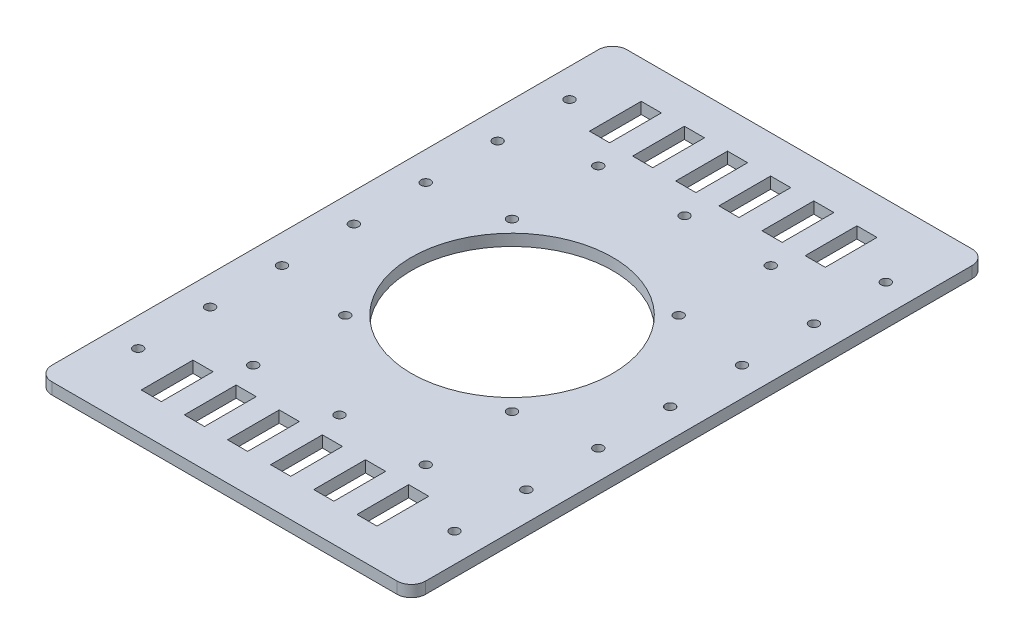
from build123d import *

# Parameters (mm, degrees)
SKETCH_1_W            = 250
SKETCH_1_H            = 100
EXTRUDE_1_DEPTH       = 4
SKETCH_2_R            = 7
SKETCH_2_R_2          = 2
SKETCH_2_R_3          = 12.5
CUT_EXTRUDE_1_DEPTH   = 10
SKETCH_3_W            = 97.153071718
SKETCH_3_H            = 57.170388118
CUT_EXTRUDE_2_DEPTH   = 10
SKETCH_5_R            = 2
CUT_EXTRUDE_3_DEPTH   = 135.688529578
SKETCH_6_W            = 100
SKETCH_6_H            = 4
EXTRUDE_2_DEPTH       = 10
EXTRUDE_3_DEPTH       = 4
SKETCH_9_W            = 57.170388118
SKETCH_9_H            = 4
EXTRUDE_4_DEPTH       = 10
FILLET_1_R            = 10
SKETCH_10_R           = 1.7
CUT_EXTRUDE_5_DEPTH   = 17
SKETCH_11_W           = 87.153071718
SKETCH_11_H           = 57.170388118
EXTRUDE_5_DEPTH       = 4
SKETCH_12_R           = 7
SKETCH_12_R_2         = 2
CUT_EXTRUDE_6_DEPTH   = 10
SKETCH_14_W           = 100
SKETCH_14_H           = 4
CUT_EXTRUDE_7_DEPTH   = 80
SKETCH_15_OUTSIDE_W   = 281.959
SKETCH_15_OUTSIDE_H   = 206.214
SKETCH_15_OUTSIDE_W_2 = 260
SKETCH_15_OUTSIDE_H_2 = 130
CUT_EXTRUDE_8_DEPTH   = 10
EXTRUDE_START         = -4
EXTRUDE_6_DEPTH       = 4
SKETCH_17_W           = 65
SKETCH_17_H           = 130
CUT_EXTRUDE_9_DEPTH   = 10
SKETCH_18_W           = 130
SKETCH_18_H           = 35
EXTRUDE_7_DEPTH       = 4
SKETCH_19_R           = 1.65
CUT_EXTRUDE_10_DEPTH  = 10
SKETCH_20_R           = 12.5
CUT_EXTRUDE_11_DEPTH  = 10
EXTRUDE_8_DEPTH       = 4
SKETCH_22_R           = 1.65
CUT_EXTRUDE_12_DEPTH  = 10
SKETCH_24_W           = 51.023920123
SKETCH_24_H           = 101.084181609
EXTRUDE_10_DEPTH      = 4
SKETCH_26_R           = 11.5
CUT_EXTRUDE_14_DEPTH  = 10
SKETCH_28_R           = 1.65
SKETCH_28_R_2         = 4.15
CUT_EXTRUDE_15_DEPTH  = 10
SKETCH_29_W           = 65
SKETCH_29_H           = 17.5
EXTRUDE_11_DEPTH      = 4
FILLET_4_R            = 5
SKETCH_30_W           = 135.504230547
SKETCH_30_H           = 189.169990082
CUT_EXTRUDE_16_DEPTH  = 10
SKETCH_31_R           = 35
CUT_EXTRUDE_17_DEPTH  = 10
SKETCH_32_R           = 1.65
CUT_EXTRUDE_18_DEPTH  = 10
SKETCH_33_W           = 7
SKETCH_33_H           = 18
CUT_EXTRUDE_19_DEPTH  = 10


with BuildPart() as part:
    # 草图1 → 凸台-拉伸1 (new body)
    with BuildSketch(Plane(origin=(0, 0, 0), x_dir=(1, 0, 0), z_dir=(0, 1, 0))):
        Rectangle(SKETCH_1_W, SKETCH_1_H)
    extrude(amount=EXTRUDE_1_DEPTH)

    # 草图2 → 切除-拉伸1 (cut)
    with BuildSketch(Plane.XZ):
        with Locations(Location((-80, 0, 0), (0, 0, 270))):
            Circle(SKETCH_2_R)
        with Locations(Location((-80, 20, 0), (0, 0, 270))):
            Circle(SKETCH_2_R_2)
        with Locations(Location((-63.141488869, -10.760604186, 0), (0, 0, 270))):
            Circle(SKETCH_2_R_2)
        with Locations(Location((-97.020085779, -10.503174762, 0), (0, 0, 270))):
            Circle(SKETCH_2_R_2)
        with Locations(Location((105.745112774, 0, 0), (0, 0, 270))):
            Circle(SKETCH_2_R_3)
    extrude(amount=-CUT_EXTRUDE_1_DEPTH, mode=Mode.SUBTRACT)

    # 草图3 → 切除-拉伸2 (cut)
    with BuildSketch(Plane.XZ):
        Rectangle(SKETCH_3_W, SKETCH_3_H)
    extrude(amount=-CUT_EXTRUDE_2_DEPTH, mode=Mode.SUBTRACT)

    # 草图5 → 切除-拉伸3 (cut, through all)
    with BuildSketch(Plane(origin=(0, 4, 0), x_dir=(1, 0, 0), z_dir=(0, 1, 0))):
        with Locations(Location((-115, 40, 0), (0, 0, 270))):
            Circle(SKETCH_5_R)
        with Locations(Location((-115, -40, 0), (0, 0, 270))):
            Circle(SKETCH_5_R)
        with Locations(Location((0, 40, 0), (0, 0, 270))):
            Circle(SKETCH_5_R)
        with Locations(Location((0, -40, 0), (0, 0, 270))):
            Circle(SKETCH_5_R)
    extrude(amount=-CUT_EXTRUDE_3_DEPTH, mode=Mode.SUBTRACT)

    # 草图6 → 凸台-拉伸2 (add)
    with BuildSketch(Plane(origin=(125, 0, 0), x_dir=(0, 0, -1), z_dir=(1, 0, 0))):
        with Locations((0, 2)):
            Rectangle(SKETCH_6_W, SKETCH_6_H)
    extrude(amount=EXTRUDE_2_DEPTH)

    # 草图7 → 凸台-拉伸3 (add)
    with BuildSketch(Plane.XZ):
        with BuildLine():
            ThreePointArc((180.745112774, 0), (132.506769507, 70.062926922), (49.843413337, 50))
            Line((49.843413337, 50), (135, 50))
            Line((135, 50), (135, -50))
            Line((135, -50), (49.843413337, -50))
            ThreePointArc((49.843413337, -50), (132.506769507, -70.062926922), (180.745112774, 0))
        make_face()
    extrude(amount=-EXTRUDE_3_DEPTH)

    # 草图9 → 凸台-拉伸4 (add)
    with BuildSketch(Plane.ZY.offset(-48.576535859)):
        with Locations((0, 2)):
            Rectangle(SKETCH_9_W, SKETCH_9_H)
    extrude(amount=EXTRUDE_4_DEPTH)

    # 圆角1
    fillet_1_edges = [part.edges().sort_by_distance(p)[0] for p in [
        (49.843413337, 2, 50),
        (49.843413337, 2, -50),
    ]]
    fillet(fillet_1_edges, radius=FILLET_1_R)

    # 草图10 → 切除-拉伸5 (cut)
    with BuildSketch(Plane.XZ):
        with Locations(Location((94.745112774, 17, 0), (0, 0, 270))):
            Circle(SKETCH_10_R)
        with Locations(Location((116.745112774, 17, 0), (0, 0, 270))):
            Circle(SKETCH_10_R)
        with Locations(Location((116.745112774, -17, 0), (0, 0, 270))):
            Circle(SKETCH_10_R)
        with Locations(Location((94.745112774, -17, 0), (0, 0, 270))):
            Circle(SKETCH_10_R)
    extrude(amount=-CUT_EXTRUDE_5_DEPTH, mode=Mode.SUBTRACT)

    # 草图11 → 凸台-拉伸5 (add)
    with BuildSketch(Plane.XZ):
        with Locations((-5, 0)):
            Rectangle(SKETCH_11_W, SKETCH_11_H)
    extrude(amount=-EXTRUDE_5_DEPTH)

    # 草图12 → 切除-拉伸6 (cut)
    with BuildSketch(Plane.XZ):
        with Locations(Location((0.75, 0, 0), (0, 0, 270))):
            Circle(SKETCH_12_R)
        with Locations(Location((-16.270085779, -10.503174762, 0), (0, 0, 270))):
            Circle(SKETCH_12_R_2)
        with Locations(Location((0.75, 20, 0), (0, 0, 270))):
            Circle(SKETCH_12_R_2)
        with Locations(Location((17.608511131, -10.760604186, 0), (0, 0, 270))):
            Circle(SKETCH_12_R_2)
    extrude(amount=-CUT_EXTRUDE_6_DEPTH, mode=Mode.SUBTRACT)

    # 草图14 → 切除-拉伸7 (cut)
    with BuildSketch(Plane.ZY.offset(125)):
        with Locations((0, 2)):
            Rectangle(SKETCH_14_W, SKETCH_14_H)
    extrude(amount=-CUT_EXTRUDE_7_DEPTH, mode=Mode.SUBTRACT)

    # 草图15 outside → 切除-拉伸8 (cut)
    with BuildSketch(Plane(origin=(0, 4, 0), x_dir=(1, 0, 0), z_dir=(0, 1, 0))):
        with Locations((67.8725, 0)):
            Rectangle(SKETCH_15_OUTSIDE_W, SKETCH_15_OUTSIDE_H)
        with Locations((105.745112774, 0)):
            Rectangle(SKETCH_15_OUTSIDE_W_2, SKETCH_15_OUTSIDE_H_2, mode=Mode.SUBTRACT)
    extrude(amount=-CUT_EXTRUDE_8_DEPTH, mode=Mode.SUBTRACT)

    # 草图16 → 凸台-拉伸6 (add)
    with BuildSketch(Plane(origin=(0, 4, 0), x_dir=(1, 0, 0), z_dir=(0, 1, 0)).offset(EXTRUDE_START)):
        with BuildLine():
            Line((235.745112774, -65), (235.745112774, 65))
            Line((235.745112774, 65), (143.161686642, 65))
            ThreePointArc((143.161686642, 65), (180.745112774, 0), (143.161686642, -65))
            Line((143.161686642, -65), (235.745112774, -65))
        make_face()
        with BuildLine():
            ThreePointArc((52.620430809, 52.941176471), (60.074733334, 59.491314003), (68.328538906, 65))
            Line((68.328538906, 65), (-24.254887226, 65))
            Line((-24.254887226, 65), (-24.254887226, 50))
            Line((-24.254887226, 50), (45.53713988, 50))
            ThreePointArc((45.53713988, 50), (49.371964824, 50.764518548), (52.620430809, 52.941176471))
        make_face()
        with BuildLine():
            Line((-24.254887226, -65), (68.328538906, -65))
            ThreePointArc((68.328538906, -65), (60.074733334, -59.491314003), (52.620430809, -52.941176471))
            ThreePointArc((52.620430809, -52.941176471), (49.371964824, -50.764518548), (45.53713988, -50))
            Line((45.53713988, -50), (-24.254887226, -50))
            Line((-24.254887226, -50), (-24.254887226, -65))
        make_face()
    extrude(amount=EXTRUDE_6_DEPTH)

    # 草图17 → 切除-拉伸9 (cut)
    with BuildSketch(Plane(origin=(0, 4, 0), x_dir=(1, 0, 0), z_dir=(0, 1, 0))):
        with Locations((203.245112774, 0)):
            Rectangle(SKETCH_17_W, SKETCH_17_H)
    extrude(amount=-CUT_EXTRUDE_9_DEPTH, mode=Mode.SUBTRACT)

    # 草图18 → 凸台-拉伸7 (add)
    with BuildSketch(Plane(origin=(0, 4, 0), x_dir=(1, 0, 0), z_dir=(0, 1, 0))):
        with Locations((105.745112774, 82.5)):
            Rectangle(SKETCH_18_W, SKETCH_18_H)
        with Locations((105.745112774, -82.5)):
            Rectangle(SKETCH_18_W, SKETCH_18_H)
    extrude(amount=-EXTRUDE_7_DEPTH)

    # 草图19 → 切除-拉伸10 (cut)
    with BuildSketch(Plane(origin=(0, 4, 0), x_dir=(1, 0, 0), z_dir=(0, 1, 0))):
        with Locations(Location((160.745112774, 0, 0), (0, 0, 270))):
            Circle(SKETCH_19_R)
        with Locations(Location((160.745112774, 25, 0), (0, 0, 270))):
            Circle(SKETCH_19_R)
        with Locations(Location((160.745112774, 50, 0), (0, 0, 270))):
            Circle(SKETCH_19_R)
        with Locations(Location((160.745112774, 75, 0), (0, 0, 270))):
            Circle(SKETCH_19_R)
        with Locations(Location((160.745112774, -25, 0), (0, 0, 270))):
            Circle(SKETCH_19_R)
        with Locations(Location((160.745112774, -50, 0), (0, 0, 270))):
            Circle(SKETCH_19_R)
        with Locations(Location((160.745112774, -75, 0), (0, 0, 270))):
            Circle(SKETCH_19_R)
        with Locations(Location((50.745112774, -75, 0), (0, 0, 270))):
            Circle(SKETCH_19_R)
        with Locations(Location((50.745112774, -50, 0), (0, 0, 270))):
            Circle(SKETCH_19_R)
        with Locations(Location((50.745112774, -25, 0), (0, 0, 270))):
            Circle(SKETCH_19_R)
        with Locations(Location((50.745112774, 75, 0), (0, 0, 270))):
            Circle(SKETCH_19_R)
        with Locations(Location((50.745112774, 50, 0), (0, 0, 270))):
            Circle(SKETCH_19_R)
        with Locations(Location((50.745112774, 25, 0), (0, 0, 270))):
            Circle(SKETCH_19_R)
        with Locations(Location((50.745112774, 0, 0), (0, 0, 270))):
            Circle(SKETCH_19_R)
    extrude(amount=-CUT_EXTRUDE_10_DEPTH, mode=Mode.SUBTRACT)

    # 草图20 → 切除-拉伸11 (cut)
    with BuildSketch(Plane(origin=(0, 4, 0), x_dir=(1, 0, 0), z_dir=(0, 1, 0))):
        with Locations(Location((0.75, 0, 0), (0, 0, 270))):
            Circle(SKETCH_20_R)
    extrude(amount=-CUT_EXTRUDE_11_DEPTH, mode=Mode.SUBTRACT)

    # 草图21 → 凸台-拉伸8 (add)
    with BuildSketch(Plane(origin=(0, 4, 0), x_dir=(1, 0, 0), z_dir=(0, 1, 0))):
        with BuildLine():
            Line((-24.254887226, 25.620218868), (-24.254887226, -25.620218868))
            ThreePointArc((-24.254887226, -25.620218868), (-35.05, 0), (-24.254887226, 25.620218868))
        make_face()
    extrude(amount=-EXTRUDE_8_DEPTH)

    # 草图22 → 切除-拉伸12 (cut)
    with BuildSketch(Plane(origin=(0, 4, 0), x_dir=(1, 0, 0), z_dir=(0, 1, 0))):
        with Locations(Location((75.745112774, 60, 0), (0, 0, 270))):
            Circle(SKETCH_22_R)
        with Locations(Location((105.745112774, 60, 0), (0, 0, 270))):
            Circle(SKETCH_22_R)
        with Locations(Location((135.745112774, 60, 0), (0, 0, 270))):
            Circle(SKETCH_22_R)
        with Locations(Location((135.745112774, -60, 0), (0, 0, 270))):
            Circle(SKETCH_22_R)
        with Locations(Location((105.745112774, -60, 0), (0, 0, 270))):
            Circle(SKETCH_22_R)
        with Locations(Location((75.745112774, -60, 0), (0, 0, 270))):
            Circle(SKETCH_22_R)
    extrude(amount=-CUT_EXTRUDE_12_DEPTH, mode=Mode.SUBTRACT)

    # 草图24 → 凸台-拉伸10 (add)
    with BuildSketch(Plane(origin=(0, 4, 0), x_dir=(1, 0, 0), z_dir=(0, 1, 0))):
        with Locations((4.36545126, -1.498313196)):
            Rectangle(SKETCH_24_W, SKETCH_24_H)
    extrude(amount=-EXTRUDE_10_DEPTH)

    # 草图26 → 切除-拉伸14 (cut)
    with BuildSketch(Plane(origin=(0, 4, 0), x_dir=(1, 0, 0), z_dir=(0, 1, 0))):
        with Locations(Location((0.75, 0, 0), (0, 0, 270))):
            Circle(SKETCH_26_R)
    extrude(amount=-CUT_EXTRUDE_14_DEPTH, mode=Mode.SUBTRACT)

    # 草图28 → 切除-拉伸15 (cut)
    with BuildSketch(Plane(origin=(0, 4, 0), x_dir=(1, 0, 0), z_dir=(0, 1, 0))):
        with Locations(Location((29.75, 0, 0), (0, 0, 270))):
            Circle(SKETCH_28_R)
        with Locations(Location((-13.75, -25.11473671, 0), (0, 0, 270))):
            Circle(SKETCH_28_R)
        with Locations(Location((-13.75, 25.11473671, 0), (0, 0, 270))):
            Circle(SKETCH_28_R)
        with Locations(Location((20, 0, 0), (0, 0, 270))):
            Circle(SKETCH_28_R_2)
    extrude(amount=-CUT_EXTRUDE_15_DEPTH, mode=Mode.SUBTRACT)

    # 草图29 → 凸台-拉伸11 (add)
    with BuildSketch(Plane(origin=(0, 4, 0), x_dir=(1, 0, 0), z_dir=(0, 1, 0))):
        with Locations((8.245112774, -73.75)):
            Rectangle(SKETCH_29_W, SKETCH_29_H)
        with Locations((8.245112774, 73.75)):
            Rectangle(SKETCH_29_W, SKETCH_29_H)
    extrude(amount=-EXTRUDE_11_DEPTH)

    # 圆角4
    fillet_4_edges = [part.edges().sort_by_distance(p)[0] for p in [
        (170.745112774, 2, -100),
        (40.745112774, 2, -100),
        (40.745112774, 2, 100),
        (170.745112774, 2, 100),
        (40.745112774, 2, 82.5),
        (-24.254887226, 2, 82.5),
        (-24.254887226, 2, -82.5),
        (40.745112774, 2, -82.5),
    ]]
    fillet(fillet_4_edges, radius=FILLET_4_R)

    # 草图30 → 切除-拉伸16 (cut)
    with BuildSketch(Plane(origin=(0, 4, 0), x_dir=(1, 0, 0), z_dir=(0, 1, 0))):
        with Locations((-27.007002499, 0.415004959)):
            Rectangle(SKETCH_30_W, SKETCH_30_H)
    extrude(amount=-CUT_EXTRUDE_16_DEPTH, mode=Mode.SUBTRACT)

    # 草图31 → 切除-拉伸17 (cut)
    with BuildSketch(Plane(origin=(0, 4, 0), x_dir=(1, 0, 0), z_dir=(0, 1, 0))):
        with Locations(Location((105.745112774, 0, 0), (0, 0, 270))):
            Circle(SKETCH_31_R)
    extrude(amount=-CUT_EXTRUDE_17_DEPTH, mode=Mode.SUBTRACT)

    # 草图32 → 切除-拉伸18 (cut)
    with BuildSketch(Plane.XZ):
        with Locations(Location((76.753734745, 28.991378029, 0), (0, 0, 270))):
            Circle(SKETCH_32_R)
        with Locations(Location((134.736490803, 28.991378029, 0), (0, 0, 270))):
            Circle(SKETCH_32_R)
        with Locations(Location((76.753734745, -28.991378029, 0), (0, 0, 270))):
            Circle(SKETCH_32_R)
        with Locations(Location((134.736490803, -28.991378029, 0), (0, 0, 270))):
            Circle(SKETCH_32_R)
    extrude(amount=-CUT_EXTRUDE_18_DEPTH, mode=Mode.SUBTRACT)

    # 草图33 → 切除-拉伸19 (cut)
    with BuildSketch(Plane.XZ):
        with Locations((82.245112774, 77.945371108)):
            Rectangle(SKETCH_33_W, SKETCH_33_H)
        with Locations((67.245112774, 77.945371108)):
            Rectangle(SKETCH_33_W, SKETCH_33_H)
        with Locations((97.245112774, 77.945371108)):
            Rectangle(SKETCH_33_W, SKETCH_33_H)
        with Locations((112.245112774, 77.945371108)):
            Rectangle(SKETCH_33_W, SKETCH_33_H)
        with Locations((127.245112774, 77.945371108)):
            Rectangle(SKETCH_33_W, SKETCH_33_H)
        with Locations((142.245112774, 77.945371108)):
            Rectangle(SKETCH_33_W, SKETCH_33_H)
        with Locations((142.245112774, -77.945371108)):
            Rectangle(SKETCH_33_W, SKETCH_33_H)
        with Locations((127.245112774, -77.945371108)):
            Rectangle(SKETCH_33_W, SKETCH_33_H)
        with Locations((112.245112774, -77.945371108)):
            Rectangle(SKETCH_33_W, SKETCH_33_H)
        with Locations((97.245112774, -77.945371108)):
            Rectangle(SKETCH_33_W, SKETCH_33_H)
        with Locations((82.245112774, -77.945371108)):
            Rectangle(SKETCH_33_W, SKETCH_33_H)
        with Locations((67.245112774, -77.945371108)):
            Rectangle(SKETCH_33_W, SKETCH_33_H)
    extrude(amount=-CUT_EXTRUDE_19_DEPTH, mode=Mode.SUBTRACT)


solid = part.part
